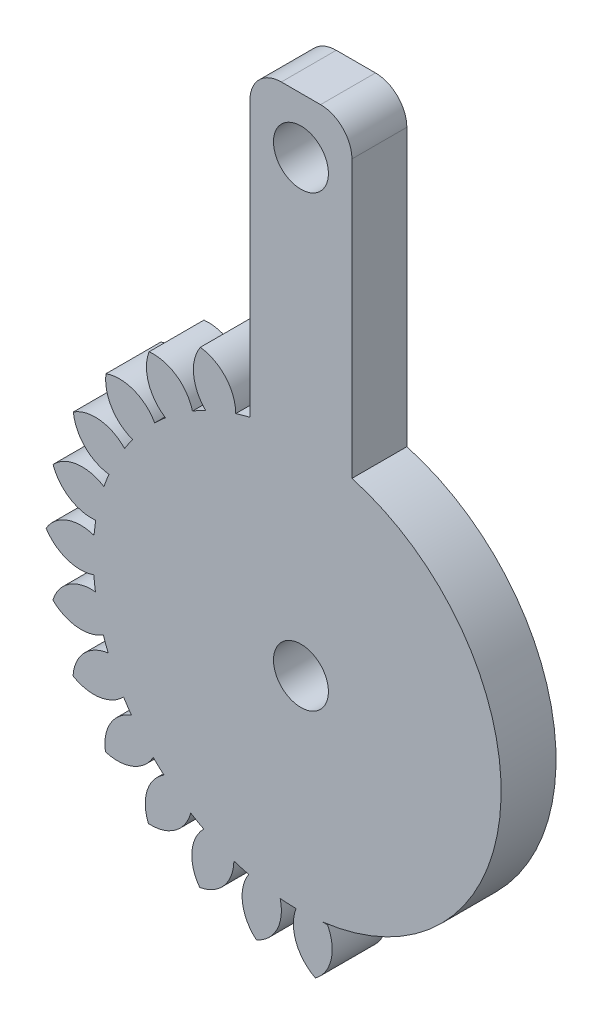
from build123d import *

# Parameters (mm, degrees)
SKETCH5_R           = 13
BOSS_EXTRUDE3_DEPTH = 3.5
SKETCH6_W           = 6.5
SKETCH6_H           = 20
BOSS_EXTRUDE4_DEPTH = 3.5
SKETCH9_R           = 1.75
CUT_EXTRUDE1_DEPTH  = 3.5
FILLET1_R           = 2
BOSS_EXTRUDE5_DEPTH = 3.5


with BuildPart() as part:
    # Sketch5 → Boss-Extrude3 (new body)
    with BuildSketch(Plane.XY.offset(3)):
        with Locations((0, 20.92523633)):
            Circle(SKETCH5_R)
    extrude(amount=BOSS_EXTRUDE3_DEPTH)

    # Sketch6 → Boss-Extrude4 (add)
    with BuildSketch(Plane.XY.offset(3)):
        with Locations((0.239986303, 43.081718219)):
            Rectangle(SKETCH6_W, SKETCH6_H)
    extrude(amount=BOSS_EXTRUDE4_DEPTH)

    # Sketch9 → Cut-Extrude1 (cut)
    with BuildSketch(Plane(origin=(0, 0, 3), x_dir=(-1, 0, 0), z_dir=(0, 0, -1))):
        with Locations((-0.239986303, 49.531718219)):
            Circle(SKETCH9_R)
        with Locations((-0.239986303, 20.92523633)):
            Circle(SKETCH9_R)
    extrude(amount=-CUT_EXTRUDE1_DEPTH, mode=Mode.SUBTRACT)

    # Fillet1
    fillet1_edges = [part.edges().sort_by_distance(p)[0] for p in [
        (-3.010013697, 53.081718219, 4.75),
        (3.489986303, 53.081718219, 4.75),
    ]]
    fillet(fillet1_edges, radius=FILLET1_R)

    # Sketch10 → Boss-Extrude5 (add)
    with BuildSketch(Plane.XY.offset(3)):
        with BuildLine():
            Line((-5.759354429, 32.464504571), (-3.919377514, 33.177547189))
            ThreePointArc((-3.919377514, 33.177547189), (-4.520656892, 34.95869799), (-6.174793625, 35.851931857))
            ThreePointArc((-6.174793625, 35.851931857), (-6.596620884, 34.081009637), (-5.759354429, 32.464504571))
        make_face()
        with BuildLine():
            Line((-8.258779816, 30.769918915), (-6.632838661, 31.888069256))
            ThreePointArc((-6.632838661, 31.888069256), (-7.628672119, 33.482544339), (-9.444215288, 33.970230789))
            ThreePointArc((-9.444215288, 33.970230789), (-9.446269369, 32.149763946), (-8.258779816, 30.769918915))
        make_face()
        with BuildLine():
            Line((-10.300034522, 28.544603873), (-8.975784035, 30.007582162))
            ThreePointArc((-8.975784035, 30.007582162), (-10.312485934, 31.329422963), (-12.191559136, 31.385270693))
            ThreePointArc((-12.191559136, 31.385270693), (-11.773729303, 29.613401065), (-10.300034522, 28.544603873))
        make_face()
        with BuildLine():
            Line((-11.773073977, 25.908526755), (-10.821904846, 27.637463454))
            ThreePointArc((-10.821904846, 27.637463454), (-12.427413239, 28.615409193), (-14.268715153, 28.236407437))
            ThreePointArc((-14.268715153, 28.236407437), (-13.45352672, 26.608656975), (-11.773073977, 25.908526755))
        make_face()
        with BuildLine():
            Line((-12.598486243, 23.00379916), (-12.071676241, 24.905486844))
            ThreePointArc((-12.071676241, 24.905486844), (-13.859437756, 25.486816213), (-15.563703318, 24.693397054))
            ThreePointArc((-15.563703318, 24.693397054), (-14.395103305, 23.297518207), (-12.598486243, 23.00379916))
        make_face()
        with BuildLine():
            Line((-12.731773131, 19.987015705), (-12.657722722, 21.958933898))
            ThreePointArc((-12.657722722, 21.958933898), (-14.531358672, 22.11230728), (-16.006710485, 20.947244151))
            ThreePointArc((-16.006710485, 20.947244151), (-14.547698421, 19.858489109), (-12.731773131, 19.987015705))
        make_face()
        with BuildLine():
            Line((-12.16574911, 17.020811966), (-12.54845037, 18.956654049))
            ThreePointArc((-12.54845037, 18.956654049), (-14.406952557, 18.673803046), (-15.573854024, 17.199904801))
            ThreePointArc((-15.573854024, 17.199904801), (-13.903085626, 16.476968629), (-12.16574911, 17.020811966))
        make_face()
        with BuildLine():
            Line((-10.930928682, 14.265096756), (-11.749750088, 16.060500981))
            ThreePointArc((-11.749750088, 16.060500981), (-13.492926178, 15.356674163), (-14.288469337, 13.653399038))
            ThreePointArc((-14.288469337, 13.653399038), (-12.496016163, 13.335255413), (-10.930928682, 14.265096756))
        make_face()
        with BuildLine():
            Line((-9.093881336, 11.868431394), (-10.304680013, 13.426607054))
            ThreePointArc((-10.304680013, 13.426607054), (-11.838554931, 12.339747907), (-12.219851845, 10.498919905))
            ThreePointArc((-12.219851845, 10.498919905), (-10.40234551, 10.602720033), (-9.093881336, 11.868431394))
        make_face()
        with BuildLine():
            Line((-6.753642769, 9.96002073), (-8.291144248, 11.196966172))
            ThreePointArc((-8.291144248, 11.196966172), (-9.533026401, 9.785667555), (-9.479521255, 7.90652619))
            ThreePointArc((-9.479521255, 7.90652619), (-7.734943995, 8.426674178), (-6.753642769, 9.96002073))
        make_face()
        with BuildLine():
            Line((-4.036375849, 8.642747678), (-5.817693027, 9.491778853))
            ThreePointArc((-5.817693027, 9.491778853), (-6.700632226, 7.832124238), (-6.215209496, 6.015974508))
            ThreePointArc((-6.215209496, 6.015974508), (-4.637611923, 6.924429043), (-4.036375849, 8.642747678))
        make_face()
        with BuildLine():
            Line((-1.088569138, 7.987626768), (-3.017670745, 8.402972186))
            ThreePointArc((-3.017670745, 8.402972186), (-3.494067509, 6.584433984), (-2.60289646, 4.92918499))
            ThreePointArc((-2.60289646, 4.92918499), (-1.277327268, 6.176971054), (-1.088569138, 7.987626768))
        make_face()
        with BuildLine():
            Line((1.93086034, 8.029975738), (-0.042027328, 7.98924402))
            ThreePointArc((-0.042027328, 7.98924402), (-0.086198985, 6.109860096), (1.162677121, 4.704746741))
            ThreePointArc((1.162677121, 4.704746741), (2.164756155, 6.224595863), (1.93086034, 8.029975738))
        make_face()
    extrude(amount=BOSS_EXTRUDE5_DEPTH)


solid = part.part
